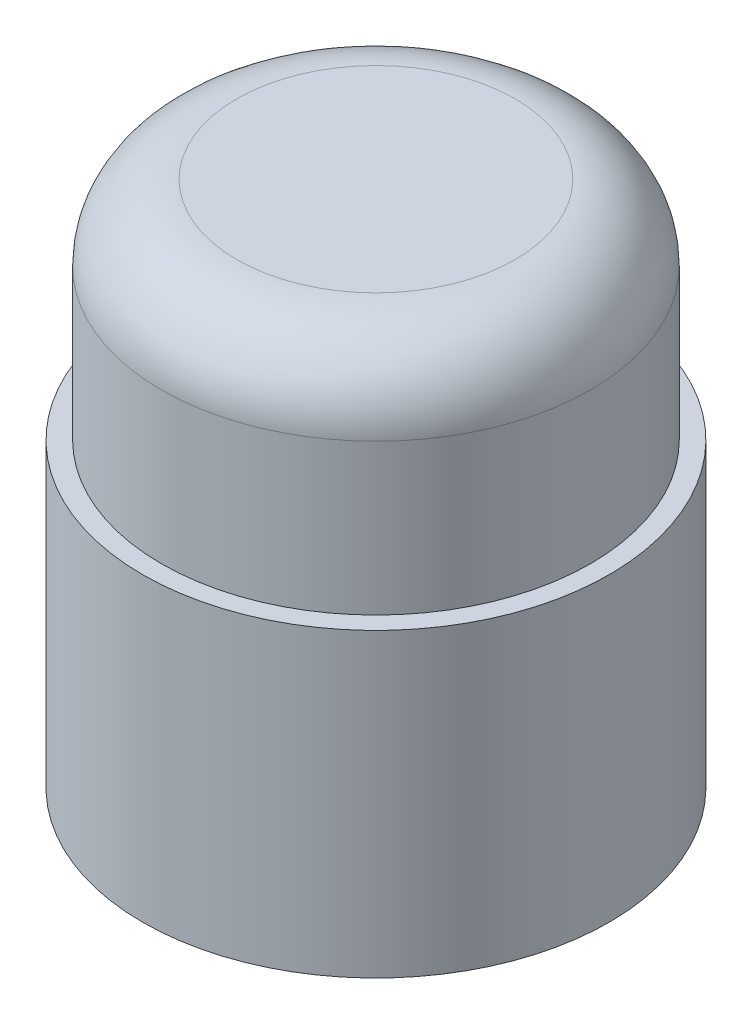
from build123d import *

# Parameters (mm, degrees)
SKETCH_1_R      = 31
EXTRUDE_1_DEPTH = 40
SKETCH_2_R      = 28.5
EXTRUDE_2_DEPTH = 30
FILLET_1_R      = 10
SHELL_1_T       = -3


with BuildPart() as part:
    # 스케치1 → 보스-돌출1 (new body)
    with BuildSketch(Plane(origin=(0, 0, 0), x_dir=(1, 0, 0), z_dir=(0, 1, 0))):
        with Locations(Location((0, 0, 0), (0, 0, 270))):
            Circle(SKETCH_1_R)
    extrude(amount=EXTRUDE_1_DEPTH)

    # 스케치2 → 보스-돌출2 (add)
    with BuildSketch(Plane(origin=(0, 40, 0), x_dir=(1, 0, 0), z_dir=(0, 1, 0))):
        with Locations(Location((0, 0, 0), (0, 0, 270))):
            Circle(SKETCH_2_R)
    extrude(amount=EXTRUDE_2_DEPTH)

    # 필렛1
    fillet_1_edges = [part.edges().sort_by_distance(p)[0] for p in [
        (0, 70, -28.5),
    ]]
    fillet(fillet_1_edges, radius=FILLET_1_R)

    # 쉘1
    shell_1_openings = [part.faces().sort_by_distance(p)[0] for p in [
        (0, 0, 0),
    ]]
    offset(amount=SHELL_1_T, openings=shell_1_openings, kind=Kind.INTERSECTION)


solid = part.part
